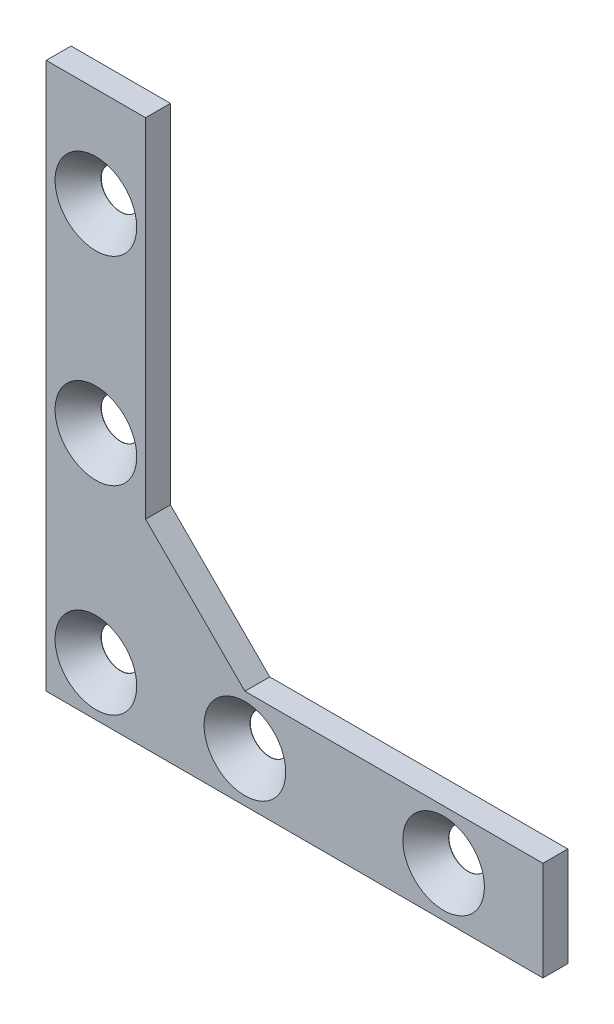
from build123d import *

# Parameters (mm, degrees)
BOSS_EXTRUDE1_DEPTH             = 3.175
F_10_CLEARANCE_HOLE1_AT_2_COUNT = 2
F_10_CLEARANCE_HOLE1_AT_2_PITCH = 25.4
F_10_CLEARANCE_HOLE1_AT_3_COUNT = 2
F_10_CLEARANCE_HOLE1_AT_3_PITCH = 50.8
F_10_CLEARANCE_HOLE1_AT_4_COUNT = 2
F_10_CLEARANCE_HOLE1_AT_4_PITCH = 19.05
F_10_CLEARANCE_HOLE1_AT_5_COUNT = 2
F_10_CLEARANCE_HOLE1_AT_5_PITCH = 44.45


with BuildPart() as part:
    # Sketch1 → Boss-Extrude1 (new body)
    with BuildSketch(Plane.XY):
        Polygon((-273.453367516, -6.35), (-273.453367516, 63.5), (-260.753367516, 63.5), (-260.753367516, 19.05), (-248.053367516, 6.35), (-209.953367516, 6.35), (-209.953367516, -6.35), align=None)
    extrude(amount=BOSS_EXTRUDE1_DEPTH)

    # Sketch4 → #10 Clearance Hole1 (revolve, cut)
    with BuildSketch(Plane(origin=(-267.103367516, 0, 3.175), x_dir=(0, -1, 0), z_dir=(1, 0, 0))):
        Polygon((0, 0), (0, 3.175), (2.4892, 3.175), (2.4892, 3.141080936), (5.2197, 0), align=None)
    f_10_clearance_hole1 = revolve(axis=Axis((-267.103367516, 0, 9.525), (0, 0, -1)), mode=Mode.SUBTRACT)

    # #10 Clearance Hole1 at 2: #10 Clearance Hole1 ×2
    with Locations(*[(0, i * F_10_CLEARANCE_HOLE1_AT_2_PITCH, 0) for i in range(1, F_10_CLEARANCE_HOLE1_AT_2_COUNT)]):
        add(f_10_clearance_hole1, mode=Mode.SUBTRACT)

    # #10 Clearance Hole1 at 3: #10 Clearance Hole1 ×2
    with Locations(*[(0, i * F_10_CLEARANCE_HOLE1_AT_3_PITCH, 0) for i in range(1, F_10_CLEARANCE_HOLE1_AT_3_COUNT)]):
        add(f_10_clearance_hole1, mode=Mode.SUBTRACT)

    # #10 Clearance Hole1 at 4: #10 Clearance Hole1 ×2
    with Locations(*[(i * F_10_CLEARANCE_HOLE1_AT_4_PITCH, 0, 0) for i in range(1, F_10_CLEARANCE_HOLE1_AT_4_COUNT)]):
        add(f_10_clearance_hole1, mode=Mode.SUBTRACT)

    # #10 Clearance Hole1 at 5: #10 Clearance Hole1 ×2
    with Locations(*[(i * F_10_CLEARANCE_HOLE1_AT_5_PITCH, 0, 0) for i in range(1, F_10_CLEARANCE_HOLE1_AT_5_COUNT)]):
        add(f_10_clearance_hole1, mode=Mode.SUBTRACT)


solid = part.part
